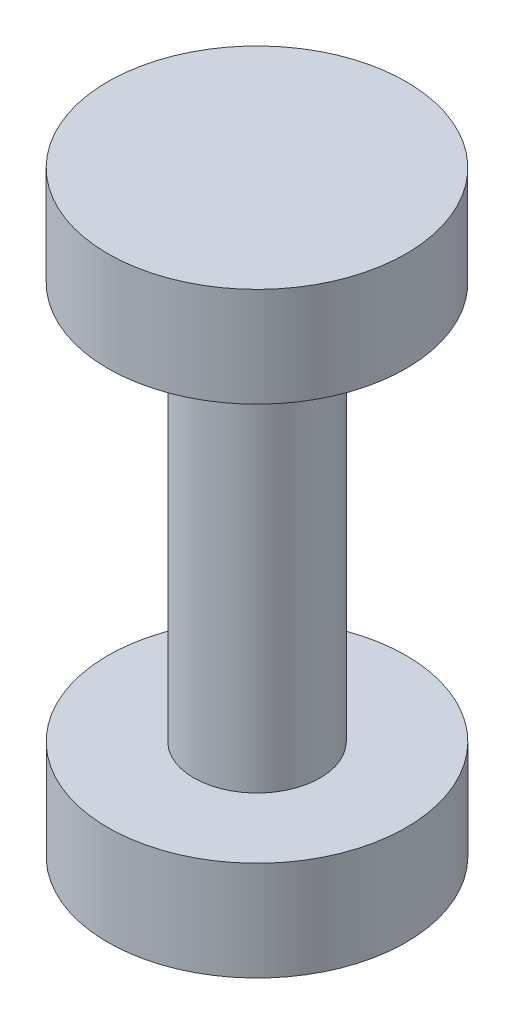
from build123d import *

# Parameters (mm, degrees)
SKETCH1_R           = 3.175
BOSS_EXTRUDE1_DEPTH = 20
SKETCH2_R           = 7.5
BOSS_EXTRUDE2_DEPTH = 5
BOSS_EXTRUDE3_START = 5
SKETCH3_R           = 7.5
BOSS_EXTRUDE3_DEPTH = 5


with BuildPart() as part:
    # Sketch1 → Boss-Extrude1 (new body)
    with BuildSketch(Plane(origin=(0, 0, 0), x_dir=(1, 0, 0), z_dir=(0, 1, 0))):
        with Locations(Location((0, 0, 0), (0, 0, 270))):
            Circle(SKETCH1_R)
    extrude(amount=BOSS_EXTRUDE1_DEPTH)

    # Sketch2 → Boss-Extrude2 (add)
    with BuildSketch(Plane(origin=(0, 20, 0), x_dir=(1, 0, 0), z_dir=(0, 1, 0))):
        with Locations(Location((0, 0, 0), (0, 0, 270))):
            Circle(SKETCH2_R)
    extrude(amount=BOSS_EXTRUDE2_DEPTH)

    # Sketch3 → Boss-Extrude3 (add)
    with BuildSketch(Plane.XZ.offset(BOSS_EXTRUDE3_START)):
        with Locations(Location((0, 0, 0), (0, 0, 90))):
            Circle(SKETCH3_R)
    extrude(amount=-BOSS_EXTRUDE3_DEPTH)


solid = part.part
